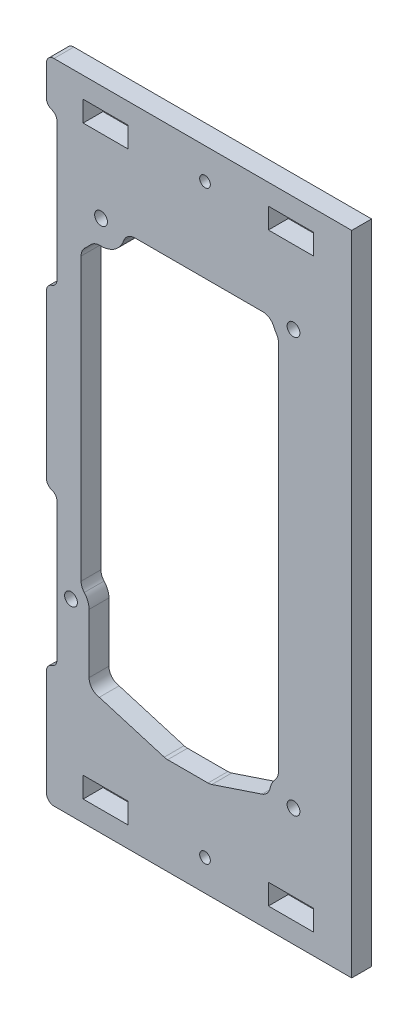
from build123d import *

# Parameters (mm, degrees)
MODEL_R             = 2.125
MODEL_R_2           = 1.775
MODEL_W             = 15
MODEL_H             = 6.86
BOSS_EXTRUDE1_DEPTH = 6.6


with BuildPart() as part:
    # Model → Boss-Extrude1 (new body)
    with BuildSketch(Plane.XY):
        with BuildLine():
            Line((-55.51, -65.37), (-55.51, -19.57))
            ThreePointArc((-55.51, -19.57), (-55.994435563, -18.090980054), (-57.26, -17.185151996))
            ThreePointArc((-57.26, -17.185151996), (-58.525564437, -16.279323939), (-59.01, -14.800303993))
            Line((-59.01, -14.800303993), (-59.01, 39.340303993))
            ThreePointArc((-59.01, 39.340303993), (-58.525564437, 40.819323939), (-57.26, 41.725151996))
            ThreePointArc((-57.26, 41.725151996), (-55.994435563, 42.630980054), (-55.51, 44.11))
            Line((-55.51, 44.11), (-55.51, 89.91))
            ThreePointArc((-55.51, 89.91), (-55.994435563, 91.389019946), (-57.26, 92.294848004))
            ThreePointArc((-57.26, 92.294848004), (-58.525564437, 93.200676061), (-59.01, 94.679696007))
            Line((-59.01, 94.679696007), (-59.01, 104.91))
            ThreePointArc((-59.01, 104.91), (-58.277766953, 106.677766953), (-56.51, 107.41))
            Line((-56.51, 107.41), (42.49, 107.41))
            Line((42.49, 107.41), (42.49, -107.87))
            Line((42.49, -107.87), (-56.51, -107.87))
            ThreePointArc((-56.51, -107.87), (-58.277766953, -107.137766953), (-59.01, -105.37))
            Line((-59.01, -105.37), (-59.01, -70.139696007))
            ThreePointArc((-59.01, -70.139696007), (-58.525564437, -68.660676061), (-57.26, -67.754848004))
            ThreePointArc((-57.26, -67.754848004), (-55.994435563, -66.849019946), (-55.51, -65.37))
        make_face()
        with Locations((-50.84, -45.4)):
            Circle(MODEL_R, mode=Mode.SUBTRACT)
        with Locations((23.1422, 69.2)):
            Circle(MODEL_R, mode=Mode.SUBTRACT)
        with Locations((-40.8578, 69.2)):
            Circle(MODEL_R, mode=Mode.SUBTRACT)
        with Locations((23.1422, -68.6)):
            Circle(MODEL_R, mode=Mode.SUBTRACT)
        with Locations((-6.285, -97.56)):
            Circle(MODEL_R_2, mode=Mode.SUBTRACT)
        with Locations((-6.285, 97.1)):
            Circle(MODEL_R_2, mode=Mode.SUBTRACT)
        with BuildLine():
            Line((-44.84, -45.4), (-44.84, -65.045820713))
            ThreePointArc((-44.84, -65.045820713), (-43.874373192, -67.652078439), (-41.443710334, -69))
            Line((-41.443710334, -69), (-19.844586098, -75.441455972))
            ThreePointArc((-19.844586098, -75.441455972), (-19.279062125, -75.566358805), (-18.701428861, -75.608286065))
            Line((-18.701428861, -75.608286065), (-5.286503503, -75.608286065))
            ThreePointArc((-5.286503503, -75.608286065), (-4.644685592, -75.556459031), (-4.01949944, -75.402320949))
            Line((-4.01949944, -75.402320949), (12.687875453, -69.822954253))
            ThreePointArc((12.687875453, -69.822954253), (14.395659936, -68.702986141), (15.327980927, -66.885946246))
            ThreePointArc((15.327980927, -66.885946246), (16.007236983, -64.981671277), (17.1422, -63.308497378))
            ThreePointArc((17.1422, -63.308497378), (17.883857387, -62.076959629), (18.1422, -60.662746067))
            Line((18.1422, -60.662746067), (18.1422, 62.87544468))
            ThreePointArc((18.1422, 62.87544468), (17.956050357, 64.081490058), (17.414927273, 65.175282978))
            ThreePointArc((17.414927273, 65.175282978), (16.973667336, 65.891041739), (16.621413149, 66.654545455))
            ThreePointArc((16.621413149, 66.654545455), (15.151553533, 68.502891295), (12.895249234, 69.2))
            Line((12.895249234, 69.2), (-29.544091501, 69.2))
            ThreePointArc((-29.544091501, 69.2), (-31.853492578, 68.465986324), (-33.315327667, 66.533333333))
            ThreePointArc((-33.315327667, 66.533333333), (-36.362052556, 62.582730554), (-41.157187314, 61.205604011))
            ThreePointArc((-41.157187314, 61.205604011), (-42.768185041, 60.931924569), (-44.135308096, 60.036833141))
            Line((-44.135308096, 60.036833141), (-46.328427125, 57.843714112))
            ThreePointArc((-46.328427125, 57.843714112), (-47.19551813, 56.546020717), (-47.5, 55.015286987))
            Line((-47.5, 55.015286987), (-47.5, -38.608505319))
            ThreePointArc((-47.5, -38.608505319), (-47.224513391, -40.067271921), (-46.436, -41.325103191))
            ThreePointArc((-46.436, -41.325103191), (-45.253229913, -43.211850097), (-44.84, -45.4))
        make_face(mode=Mode.SUBTRACT)
        with Locations((-39.31, 97.1)):
            Rectangle(MODEL_W, MODEL_H, mode=Mode.SUBTRACT)
        with Locations((22.29, 97.1)):
            Rectangle(MODEL_W, MODEL_H, mode=Mode.SUBTRACT)
        with Locations((-39.31, -97.56)):
            Rectangle(MODEL_W, MODEL_H, mode=Mode.SUBTRACT)
        with Locations((22.29, -97.56)):
            Rectangle(MODEL_W, MODEL_H, mode=Mode.SUBTRACT)
    extrude(amount=BOSS_EXTRUDE1_DEPTH)


solid = part.part
